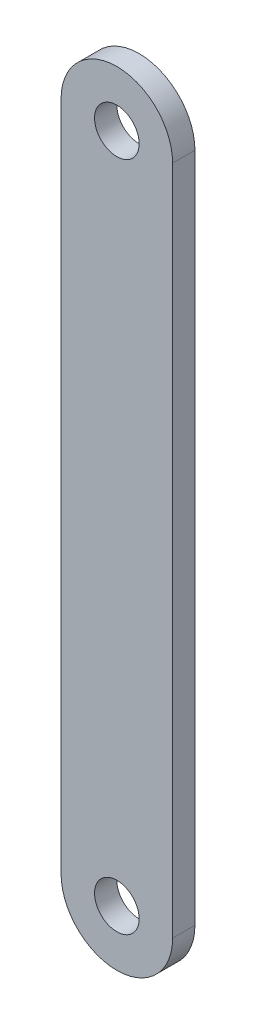
from build123d import *

# Parameters (mm, degrees)
CROQUIS1_R              = 10
SALIENTE_EXTRUIR1_DEPTH = 10


with BuildPart() as part:
    # Croquis1 → Saliente-Extruir1 (new body)
    with BuildSketch(Plane.XY):
        with BuildLine():
            Line((50, 0), (50, 300.9))
            ThreePointArc((50, 300.9), (25, 325.9), (0, 300.9))
            Line((0, 300.9), (0, 0))
            ThreePointArc((0, 0), (25, -25), (50, 0))
        make_face()
        with Locations((25, 300.9)):
            Circle(CROQUIS1_R, mode=Mode.SUBTRACT)
        with Locations((25, 0)):
            Circle(CROQUIS1_R, mode=Mode.SUBTRACT)
    extrude(amount=SALIENTE_EXTRUIR1_DEPTH)


solid = part.part
